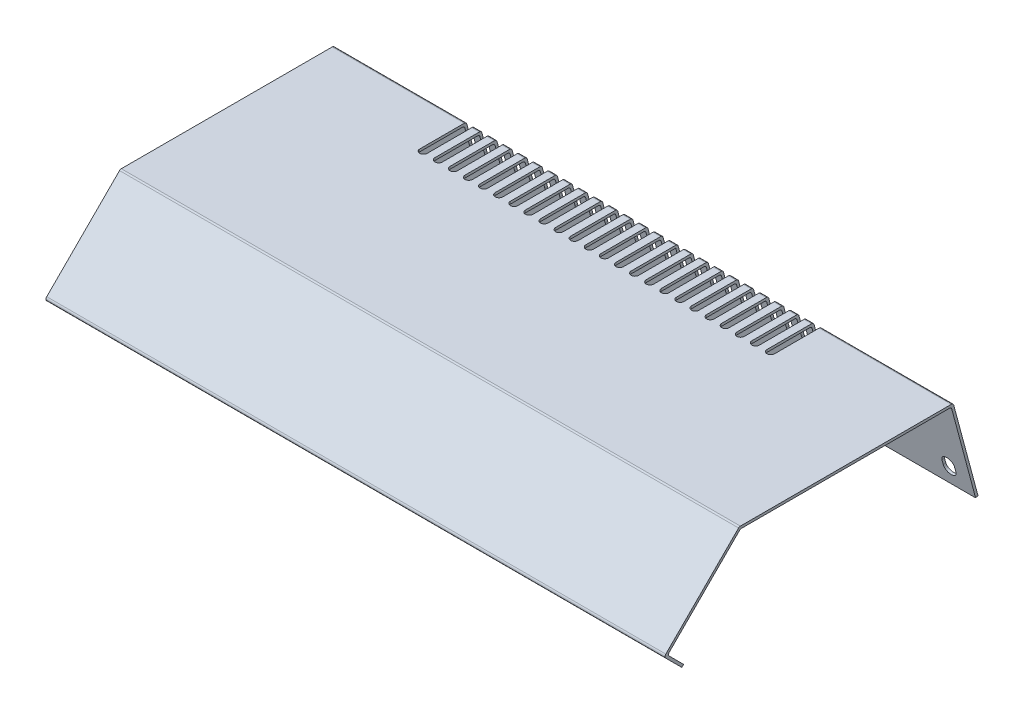
from build123d import *

# Parameters (mm, degrees)
EXTRUDE_1_DEPTH     = 123
CUT_EXTRUDE_1_DEPTH = 10
CUT_EXTRUDE_2_DEPTH = 10
CUT_EXTRUDE_3_REACH = 176.418
FILLET_1_R          = 1


with BuildPart() as part:
    # Эскиз1 → Бобышка-Вытянуть1 (new, symmetric)
    with BuildSketch(Plane(origin=(0, 0, 0), x_dir=(0, 0, -1), z_dir=(1, 0, 0))):
        Polygon((-42.5, 37), (42.5, 37), (52.344769766, 0.258819045), (51.37884394, 0), (41.732673012, 36), (-42.085786438, 36), (-71.014718626, 7.071067812), (-64.650757595, 0.707106781), (-65.357864376, 0), (-72.428932188, 7.071067812), align=None)
    extrude(amount=EXTRUDE_1_DEPTH, both=True)

    # Эскиз2 → Вырез-Вытянуть1 (cut)
    with BuildSketch(Plane(origin=(0, 37, 0), x_dir=(1, 0, 0), z_dir=(0, 1, 0))):
        with BuildLine():
            Line((-70.5, 42.5), (-70.5, 24))
            ThreePointArc((-70.5, 24), (-69, 22.5), (-67.5, 24))
            Line((-67.5, 24), (-67.5, 42.5))
            Line((-67.5, 42.5), (-70.5, 42.5))
        make_face()
        with BuildLine():
            Line((-64.5, 42.5), (-64.5, 24))
            ThreePointArc((-64.5, 24), (-63, 22.5), (-61.5, 24))
            Line((-61.5, 24), (-61.5, 42.5))
            Line((-61.5, 42.5), (-64.5, 42.5))
        make_face()
        with BuildLine():
            Line((-58.5, 42.5), (-58.5, 24))
            ThreePointArc((-58.5, 24), (-57, 22.5), (-55.5, 24))
            Line((-55.5, 24), (-55.5, 42.5))
            Line((-55.5, 42.5), (-58.5, 42.5))
        make_face()
        with BuildLine():
            Line((-52.5, 42.5), (-52.5, 24))
            ThreePointArc((-52.5, 24), (-51, 22.5), (-49.5, 24))
            Line((-49.5, 24), (-49.5, 42.5))
            Line((-49.5, 42.5), (-52.5, 42.5))
        make_face()
        with BuildLine():
            Line((-46.5, 42.5), (-46.5, 24))
            ThreePointArc((-46.5, 24), (-45, 22.5), (-43.5, 24))
            Line((-43.5, 24), (-43.5, 42.5))
            Line((-43.5, 42.5), (-46.5, 42.5))
        make_face()
        with BuildLine():
            Line((-40.5, 42.5), (-40.5, 24))
            ThreePointArc((-40.5, 24), (-39, 22.5), (-37.5, 24))
            Line((-37.5, 24), (-37.5, 42.5))
            Line((-37.5, 42.5), (-40.5, 42.5))
        make_face()
        with BuildLine():
            Line((-34.5, 42.5), (-34.5, 24))
            ThreePointArc((-34.5, 24), (-33, 22.5), (-31.5, 24))
            Line((-31.5, 24), (-31.5, 42.5))
            Line((-31.5, 42.5), (-34.5, 42.5))
        make_face()
        with BuildLine():
            Line((-28.5, 42.5), (-28.5, 24))
            ThreePointArc((-28.5, 24), (-27, 22.5), (-25.5, 24))
            Line((-25.5, 24), (-25.5, 42.5))
            Line((-25.5, 42.5), (-28.5, 42.5))
        make_face()
        with BuildLine():
            Line((-22.5, 42.5), (-22.5, 24))
            ThreePointArc((-22.5, 24), (-21, 22.5), (-19.5, 24))
            Line((-19.5, 24), (-19.5, 42.5))
            Line((-19.5, 42.5), (-22.5, 42.5))
        make_face()
        with BuildLine():
            Line((-16.5, 42.5), (-16.5, 24))
            ThreePointArc((-16.5, 24), (-15, 22.5), (-13.5, 24))
            Line((-13.5, 24), (-13.5, 42.5))
            Line((-13.5, 42.5), (-16.5, 42.5))
        make_face()
        with BuildLine():
            Line((-10.5, 42.5), (-10.5, 24))
            ThreePointArc((-10.5, 24), (-9, 22.5), (-7.5, 24))
            Line((-7.5, 24), (-7.5, 42.5))
            Line((-7.5, 42.5), (-10.5, 42.5))
        make_face()
        with BuildLine():
            Line((-4.5, 42.5), (-4.5, 24))
            ThreePointArc((-4.5, 24), (-3, 22.5), (-1.5, 24))
            Line((-1.5, 24), (-1.5, 42.5))
            Line((-1.5, 42.5), (-4.5, 42.5))
        make_face()
        with BuildLine():
            Line((1.5, 42.5), (1.5, 24))
            ThreePointArc((1.5, 24), (3, 22.5), (4.5, 24))
            Line((4.5, 24), (4.5, 42.5))
            Line((4.5, 42.5), (1.5, 42.5))
        make_face()
        with BuildLine():
            Line((7.5, 42.5), (7.5, 24))
            ThreePointArc((7.5, 24), (9, 22.5), (10.5, 24))
            Line((10.5, 24), (10.5, 42.5))
            Line((10.5, 42.5), (7.5, 42.5))
        make_face()
        with BuildLine():
            Line((13.5, 42.5), (13.5, 24))
            ThreePointArc((13.5, 24), (15, 22.5), (16.5, 24))
            Line((16.5, 24), (16.5, 42.5))
            Line((16.5, 42.5), (13.5, 42.5))
        make_face()
        with BuildLine():
            Line((19.5, 42.5), (19.5, 24))
            ThreePointArc((19.5, 24), (21, 22.5), (22.5, 24))
            Line((22.5, 24), (22.5, 42.5))
            Line((22.5, 42.5), (19.5, 42.5))
        make_face()
        with BuildLine():
            Line((25.5, 42.5), (25.5, 24))
            ThreePointArc((25.5, 24), (27, 22.5), (28.5, 24))
            Line((28.5, 24), (28.5, 42.5))
            Line((28.5, 42.5), (25.5, 42.5))
        make_face()
        with BuildLine():
            Line((31.5, 42.5), (31.5, 24))
            ThreePointArc((31.5, 24), (33, 22.5), (34.5, 24))
            Line((34.5, 24), (34.5, 42.5))
            Line((34.5, 42.5), (31.5, 42.5))
        make_face()
        with BuildLine():
            Line((37.5, 42.5), (37.5, 24))
            ThreePointArc((37.5, 24), (39, 22.5), (40.5, 24))
            Line((40.5, 24), (40.5, 42.5))
            Line((40.5, 42.5), (37.5, 42.5))
        make_face()
        with BuildLine():
            Line((43.5, 42.5), (43.5, 24))
            ThreePointArc((43.5, 24), (45, 22.5), (46.5, 24))
            Line((46.5, 24), (46.5, 42.5))
            Line((46.5, 42.5), (43.5, 42.5))
        make_face()
        with BuildLine():
            Line((49.5, 42.5), (49.5, 24))
            ThreePointArc((49.5, 24), (51, 22.5), (52.5, 24))
            Line((52.5, 24), (52.5, 42.5))
            Line((52.5, 42.5), (49.5, 42.5))
        make_face()
        with BuildLine():
            Line((55.5, 42.5), (55.5, 24))
            ThreePointArc((55.5, 24), (57, 22.5), (58.5, 24))
            Line((58.5, 24), (58.5, 42.5))
            Line((58.5, 42.5), (55.5, 42.5))
        make_face()
        with BuildLine():
            Line((61.5, 42.5), (61.5, 24))
            ThreePointArc((61.5, 24), (63, 22.5), (64.5, 24))
            Line((64.5, 24), (64.5, 42.5))
            Line((64.5, 42.5), (61.5, 42.5))
        make_face()
        with BuildLine():
            Line((67.5, 42.5), (67.5, 24))
            ThreePointArc((67.5, 24), (69, 22.5), (70.5, 24))
            Line((70.5, 24), (70.5, 42.5))
            Line((70.5, 42.5), (67.5, 42.5))
        make_face()
    extrude(amount=-CUT_EXTRUDE_1_DEPTH, mode=Mode.SUBTRACT)

    # Эскиз3 → Вырез-Вытянуть2 (cut)
    with BuildSketch(Plane(origin=(0, 13.10353003, -48.90303983), x_dir=(-1, 0, 0), z_dir=(0, 0.25881904510251874, -0.9659258262890689))):
        with BuildLine():
            Line((-70.5, 24.739446156), (-70.5, 16.239446156))
            ThreePointArc((-70.5, 16.239446156), (-69, 14.739446156), (-67.5, 16.239446156))
            Line((-67.5, 16.239446156), (-67.5, 24.739446156))
            Line((-67.5, 24.739446156), (-70.5, 24.739446156))
        make_face()
        with BuildLine():
            Line((-64.5, 24.739446156), (-61.5, 24.739446156))
            Line((-61.5, 24.739446156), (-61.5, 16.239446156))
            ThreePointArc((-61.5, 16.239446156), (-63, 14.739446156), (-64.5, 16.239446156))
            Line((-64.5, 16.239446156), (-64.5, 24.739446156))
        make_face()
        with BuildLine():
            Line((-58.5, 24.739446156), (-55.5, 24.739446156))
            Line((-55.5, 24.739446156), (-55.5, 16.239446156))
            ThreePointArc((-55.5, 16.239446156), (-57, 14.739446156), (-58.5, 16.239446156))
            Line((-58.5, 16.239446156), (-58.5, 24.739446156))
        make_face()
        with BuildLine():
            Line((-52.5, 24.739446156), (-49.5, 24.739446156))
            Line((-49.5, 24.739446156), (-49.5, 16.239446156))
            ThreePointArc((-49.5, 16.239446156), (-51, 14.739446156), (-52.5, 16.239446156))
            Line((-52.5, 16.239446156), (-52.5, 24.739446156))
        make_face()
        with BuildLine():
            Line((-46.5, 24.739446156), (-43.5, 24.739446156))
            Line((-43.5, 24.739446156), (-43.5, 16.239446156))
            ThreePointArc((-43.5, 16.239446156), (-45, 14.739446156), (-46.5, 16.239446156))
            Line((-46.5, 16.239446156), (-46.5, 24.739446156))
        make_face()
        with BuildLine():
            Line((-40.5, 24.739446156), (-37.5, 24.739446156))
            Line((-37.5, 24.739446156), (-37.5, 16.239446156))
            ThreePointArc((-37.5, 16.239446156), (-39, 14.739446156), (-40.5, 16.239446156))
            Line((-40.5, 16.239446156), (-40.5, 24.739446156))
        make_face()
        with BuildLine():
            Line((-34.5, 24.739446156), (-31.5, 24.739446156))
            Line((-31.5, 24.739446156), (-31.5, 16.239446156))
            ThreePointArc((-31.5, 16.239446156), (-33, 14.739446156), (-34.5, 16.239446156))
            Line((-34.5, 16.239446156), (-34.5, 24.739446156))
        make_face()
        with BuildLine():
            Line((-28.5, 24.739446156), (-25.5, 24.739446156))
            Line((-25.5, 24.739446156), (-25.5, 16.239446156))
            ThreePointArc((-25.5, 16.239446156), (-27, 14.739446156), (-28.5, 16.239446156))
            Line((-28.5, 16.239446156), (-28.5, 24.739446156))
        make_face()
        with BuildLine():
            Line((-22.5, 24.739446156), (-19.5, 24.739446156))
            Line((-19.5, 24.739446156), (-19.5, 16.239446156))
            ThreePointArc((-19.5, 16.239446156), (-21, 14.739446156), (-22.5, 16.239446156))
            Line((-22.5, 16.239446156), (-22.5, 24.739446156))
        make_face()
        with BuildLine():
            Line((-16.5, 24.739446156), (-13.5, 24.739446156))
            Line((-13.5, 24.739446156), (-13.5, 16.239446156))
            ThreePointArc((-13.5, 16.239446156), (-15, 14.739446156), (-16.5, 16.239446156))
            Line((-16.5, 16.239446156), (-16.5, 24.739446156))
        make_face()
        with BuildLine():
            Line((-10.5, 24.739446156), (-7.5, 24.739446156))
            Line((-7.5, 24.739446156), (-7.5, 16.239446156))
            ThreePointArc((-7.5, 16.239446156), (-9, 14.739446156), (-10.5, 16.239446156))
            Line((-10.5, 16.239446156), (-10.5, 24.739446156))
        make_face()
        with BuildLine():
            Line((-4.5, 24.739446156), (-1.5, 24.739446156))
            Line((-1.5, 24.739446156), (-1.5, 16.239446156))
            ThreePointArc((-1.5, 16.239446156), (-3, 14.739446156), (-4.5, 16.239446156))
            Line((-4.5, 16.239446156), (-4.5, 24.739446156))
        make_face()
        with BuildLine():
            Line((1.5, 24.739446156), (4.5, 24.739446156))
            Line((4.5, 24.739446156), (4.5, 16.239446156))
            ThreePointArc((4.5, 16.239446156), (3, 14.739446156), (1.5, 16.239446156))
            Line((1.5, 16.239446156), (1.5, 24.739446156))
        make_face()
        with BuildLine():
            Line((7.5, 24.739446156), (10.5, 24.739446156))
            Line((10.5, 24.739446156), (10.5, 16.239446156))
            ThreePointArc((10.5, 16.239446156), (9, 14.739446156), (7.5, 16.239446156))
            Line((7.5, 16.239446156), (7.5, 24.739446156))
        make_face()
        with BuildLine():
            Line((13.5, 24.739446156), (16.5, 24.739446156))
            Line((16.5, 24.739446156), (16.5, 16.239446156))
            ThreePointArc((16.5, 16.239446156), (15, 14.739446156), (13.5, 16.239446156))
            Line((13.5, 16.239446156), (13.5, 24.739446156))
        make_face()
        with BuildLine():
            Line((19.5, 24.739446156), (22.5, 24.739446156))
            Line((22.5, 24.739446156), (22.5, 16.239446156))
            ThreePointArc((22.5, 16.239446156), (21, 14.739446156), (19.5, 16.239446156))
            Line((19.5, 16.239446156), (19.5, 24.739446156))
        make_face()
        with BuildLine():
            Line((25.5, 24.739446156), (28.5, 24.739446156))
            Line((28.5, 24.739446156), (28.5, 16.239446156))
            ThreePointArc((28.5, 16.239446156), (27, 14.739446156), (25.5, 16.239446156))
            Line((25.5, 16.239446156), (25.5, 24.739446156))
        make_face()
        with BuildLine():
            Line((31.5, 24.739446156), (34.5, 24.739446156))
            Line((34.5, 24.739446156), (34.5, 16.239446156))
            ThreePointArc((34.5, 16.239446156), (33, 14.739446156), (31.5, 16.239446156))
            Line((31.5, 16.239446156), (31.5, 24.739446156))
        make_face()
        with BuildLine():
            Line((37.5, 24.739446156), (40.5, 24.739446156))
            Line((40.5, 24.739446156), (40.5, 16.239446156))
            ThreePointArc((40.5, 16.239446156), (39, 14.739446156), (37.5, 16.239446156))
            Line((37.5, 16.239446156), (37.5, 24.739446156))
        make_face()
        with BuildLine():
            Line((43.5, 24.739446156), (46.5, 24.739446156))
            Line((46.5, 24.739446156), (46.5, 16.239446156))
            ThreePointArc((46.5, 16.239446156), (45, 14.739446156), (43.5, 16.239446156))
            Line((43.5, 16.239446156), (43.5, 24.739446156))
        make_face()
        with BuildLine():
            Line((49.5, 24.739446156), (52.5, 24.739446156))
            Line((52.5, 24.739446156), (52.5, 16.239446156))
            ThreePointArc((52.5, 16.239446156), (51, 14.739446156), (49.5, 16.239446156))
            Line((49.5, 16.239446156), (49.5, 24.739446156))
        make_face()
        with BuildLine():
            Line((55.5, 24.739446156), (58.5, 24.739446156))
            Line((58.5, 24.739446156), (58.5, 16.239446156))
            ThreePointArc((58.5, 16.239446156), (57, 14.739446156), (55.5, 16.239446156))
            Line((55.5, 16.239446156), (55.5, 24.739446156))
        make_face()
        with BuildLine():
            Line((61.5, 24.739446156), (64.5, 24.739446156))
            Line((64.5, 24.739446156), (64.5, 16.239446156))
            ThreePointArc((64.5, 16.239446156), (63, 14.739446156), (61.5, 16.239446156))
            Line((61.5, 16.239446156), (61.5, 24.739446156))
        make_face()
        with BuildLine():
            Line((67.5, 24.739446156), (70.5, 24.739446156))
            Line((70.5, 24.739446156), (70.5, 16.239446156))
            ThreePointArc((70.5, 16.239446156), (69, 14.739446156), (67.5, 16.239446156))
            Line((67.5, 16.239446156), (67.5, 24.739446156))
        make_face()
    extrude(amount=-CUT_EXTRUDE_2_DEPTH, mode=Mode.SUBTRACT)

    # Эскиз4 → Вырез-Вытянуть3 (cut, up to next)
    with BuildSketch(Plane(origin=(0, 13.10353003, -48.90303983), x_dir=(-1, 0, 0), z_dir=(0, 0.25881904510251874, -0.9659258262890689)), mode=Mode.PRIVATE) as cut_extrude_3_sk1:
        with BuildLine():
            Line((-117, -6.297823327), (-117, -4.297823327))
            ThreePointArc((-117, -4.297823327), (-114.5, -1.797823327), (-112, -4.297823327))
            Line((-112, -4.297823327), (-112, -6.297823327))
            ThreePointArc((-112, -6.297823327), (-114.5, -8.797823327), (-117, -6.297823327))
        make_face()
    cut_extrude_3_tool1 = extrude(cut_extrude_3_sk1.sketch, amount=-CUT_EXTRUDE_3_REACH, mode=Mode.PRIVATE) & part.part
    # Эскиз4 → Вырез-Вытянуть3 (cut, up to next)
    with BuildSketch(Plane(origin=(0, 13.10353003, -48.90303983), x_dir=(-1, 0, 0), z_dir=(0, 0.25881904510251874, -0.9659258262890689)), mode=Mode.PRIVATE) as cut_extrude_3_sk2:
        with BuildLine():
            Line((112, -6.297823327), (112, -4.297823327))
            ThreePointArc((112, -4.297823327), (114.5, -1.797823327), (117, -4.297823327))
            Line((117, -4.297823327), (117, -6.297823327))
            ThreePointArc((117, -6.297823327), (114.5, -8.797823327), (112, -6.297823327))
        make_face()
    cut_extrude_3_tool2 = extrude(cut_extrude_3_sk2.sketch, amount=-CUT_EXTRUDE_3_REACH, mode=Mode.PRIVATE) & part.part
    add(cut_extrude_3_tool1.solids().sort_by_distance((114.5, 7.986226, -50.274217))[0], mode=Mode.SUBTRACT)
    add(cut_extrude_3_tool2.solids().sort_by_distance((-114.5, 7.986226, -50.274217))[0], mode=Mode.SUBTRACT)

    # Скругление1
    fillet_1_edges = [part.edges().sort_by_distance(p)[0] for p in [
        (0, 7.071067812, 72.428932188),
        (0, 37, 42.5),
        (96.75, 37, -42.5),
        (96.75, 36, -41.732673012),
        (0, 36, 42.085786438),
        (0, 7.071067812, 71.014718626),
        (66, 37, -42.5),
        (60, 37, -42.5),
        (54, 37, -42.5),
        (48, 37, -42.5),
        (42, 37, -42.5),
        (36, 37, -42.5),
        (30, 37, -42.5),
        (24, 37, -42.5),
        (18, 37, -42.5),
        (12, 37, -42.5),
        (6, 37, -42.5),
        (0, 37, -42.5),
        (-6, 37, -42.5),
        (-12, 37, -42.5),
        (-18, 37, -42.5),
        (-24, 37, -42.5),
        (-30, 37, -42.5),
        (-36, 37, -42.5),
        (-42, 37, -42.5),
        (-48, 37, -42.5),
        (-54, 37, -42.5),
        (-60, 37, -42.5),
        (-66, 37, -42.5),
        (-96.75, 37, -42.5),
        (66, 36, -41.732673012),
        (60, 36, -41.732673012),
        (54, 36, -41.732673012),
        (48, 36, -41.732673012),
        (42, 36, -41.732673012),
        (36, 36, -41.732673012),
        (30, 36, -41.732673012),
        (24, 36, -41.732673012),
        (18, 36, -41.732673012),
        (6, 36, -41.732673012),
        (0, 36, -41.732673012),
        (-6, 36, -41.732673012),
        (-12, 36, -41.732673012),
        (-18, 36, -41.732673012),
        (-24, 36, -41.732673012),
        (-30, 36, -41.732673012),
        (-36, 36, -41.732673012),
        (-42, 36, -41.732673012),
        (-48, 36, -41.732673012),
        (-54, 36, -41.732673012),
        (-60, 36, -41.732673012),
        (-66, 36, -41.732673012),
        (-96.75, 36, -41.732673012),
    ]]
    fillet(fillet_1_edges, radius=FILLET_1_R)


solid = part.part
